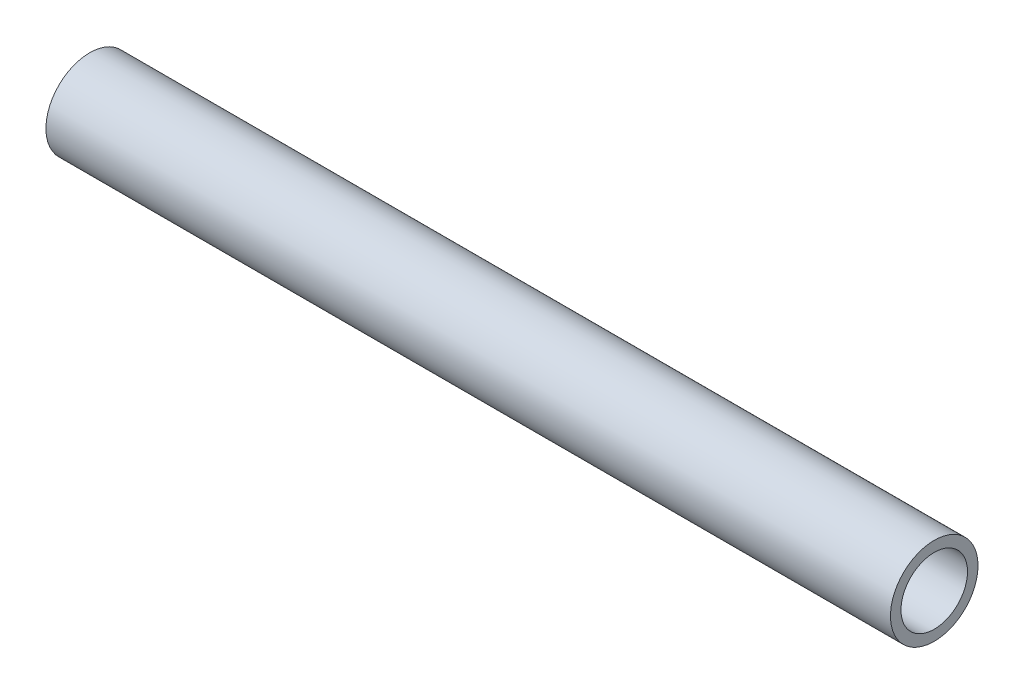
from build123d import *

# Parameters (mm, degrees)
SKETCH1_R           = 12.7
SKETCH1_R_2         = 9.652
BOSS_EXTRUDE1_DEPTH = 245


with BuildPart() as part:
    # Sketch1 → Boss-Extrude1 (new body)
    with BuildSketch(Plane(origin=(0, 0, 0), x_dir=(0, 0, -1), z_dir=(1, 0, 0))):
        Circle(SKETCH1_R)
        Circle(SKETCH1_R_2, mode=Mode.SUBTRACT)
    extrude(amount=BOSS_EXTRUDE1_DEPTH)


solid = part.part
